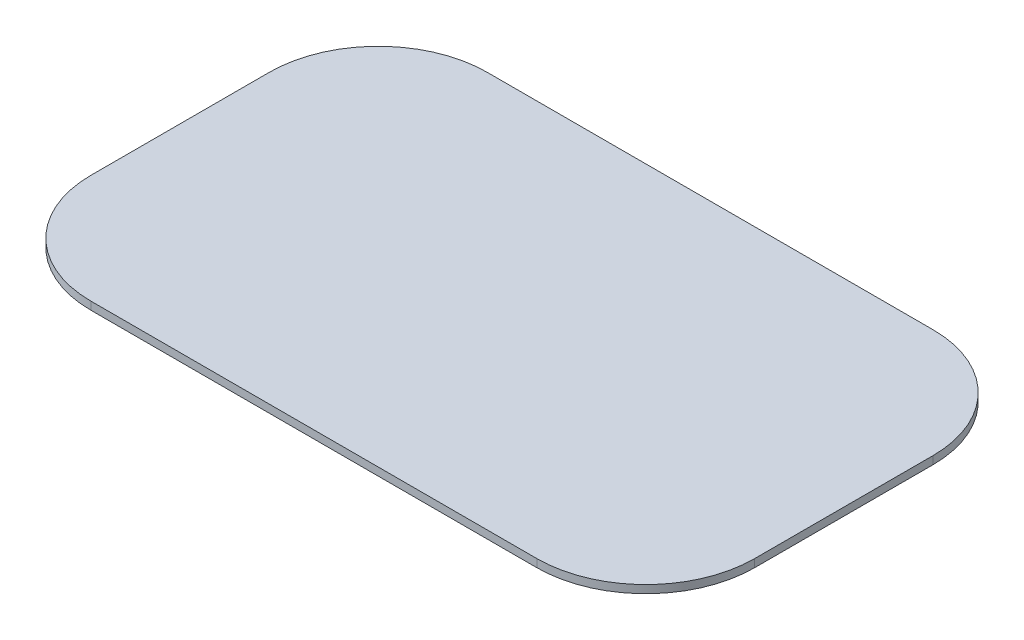
from build123d import *

# Parameters (mm, degrees)
BOSS_EXTRUDE1_DEPTH = 4


with BuildPart() as part:
    # Sketch1 → Boss-Extrude1 (new body)
    with BuildSketch(Plane(origin=(0, 0, 0), x_dir=(1, 0, 0), z_dir=(0, 1, 0))):
        with BuildLine():
            Line((55, 0), (280, 0))
            ThreePointArc((280, 0), (318.890872965, 16.109127035), (335, 55))
            Line((335, 55), (335, 145))
            ThreePointArc((335, 145), (318.890872965, 183.890872965), (280, 200))
            Line((280, 200), (55, 200))
            ThreePointArc((55, 200), (16.109127035, 183.890872965), (0, 145))
            Line((0, 145), (0, 55))
            ThreePointArc((0, 55), (16.109127035, 16.109127035), (55, 0))
        make_face()
    extrude(amount=BOSS_EXTRUDE1_DEPTH)


solid = part.part
